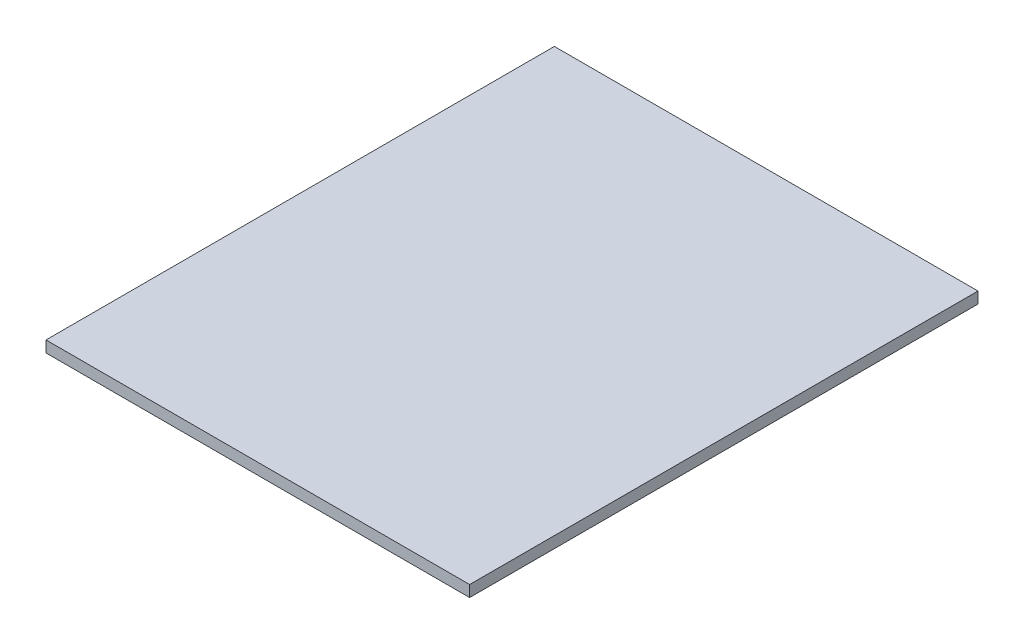
from build123d import *

# Parameters (mm, degrees)
SKETCH1_W           = 95.25
SKETCH1_H           = 114.3
BOSS_EXTRUDE1_DEPTH = 2.54


with BuildPart() as part:
    # Sketch1 → Boss-Extrude1 (new body)
    with BuildSketch(Plane(origin=(0, 0, 0), x_dir=(1, 0, 0), z_dir=(0, 1, 0))):
        Rectangle(SKETCH1_W, SKETCH1_H)
    extrude(amount=BOSS_EXTRUDE1_DEPTH)


solid = part.part
